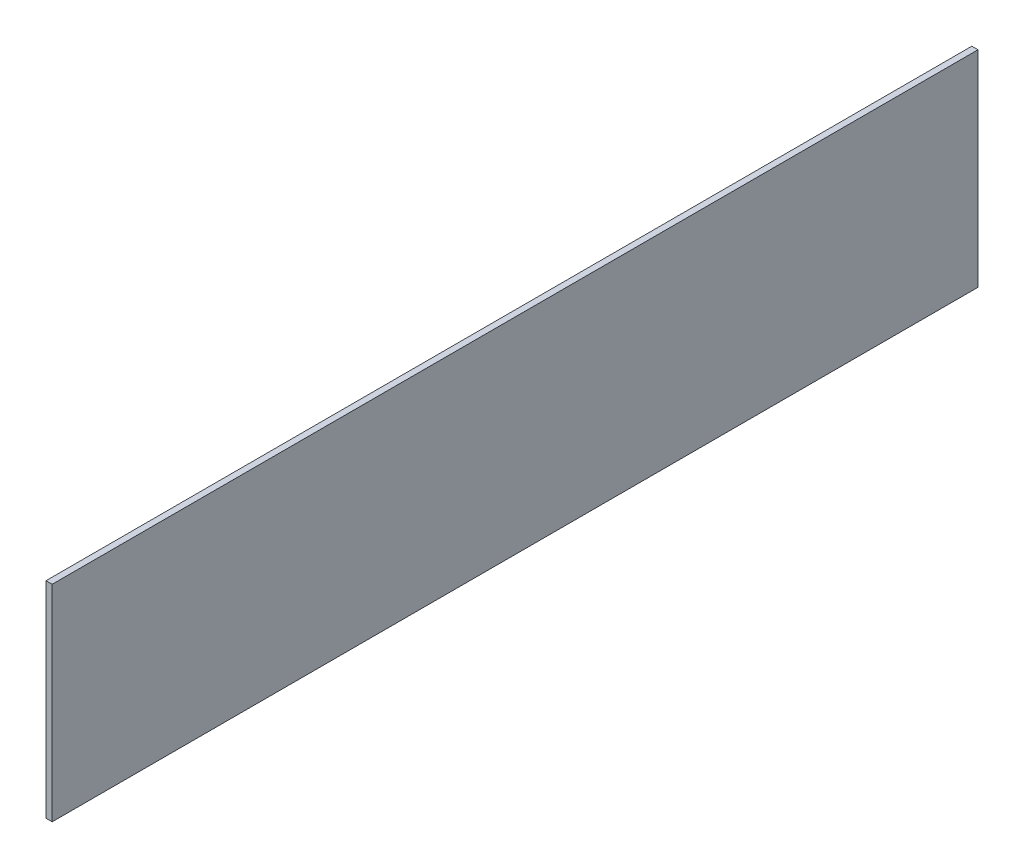
from build123d import *

# Parameters (mm, degrees)
SKETCH1_W           = 450
SKETCH1_H           = 100
BOSS_EXTRUDE1_DEPTH = 3


with BuildPart() as part:
    # Sketch1 → Boss-Extrude1 (new body)
    with BuildSketch(Plane(origin=(0, 0, 0), x_dir=(0, 0, -1), z_dir=(1, 0, 0))):
        Rectangle(SKETCH1_W, SKETCH1_H)
    extrude(amount=BOSS_EXTRUDE1_DEPTH)


solid = part.part
